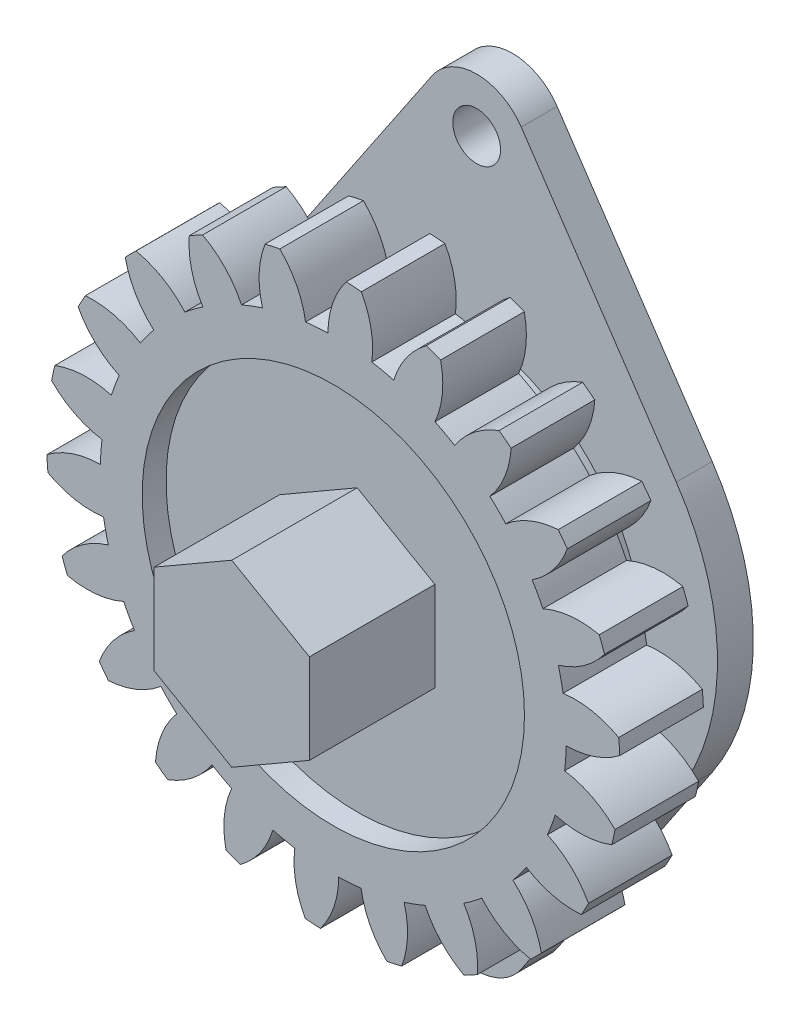
from build123d import *

# Parameters (mm, degrees)
EXTRUDE_1_DEPTH          = 3.5
SKETCH_2_R               = 19.5
EXTRUDE_2_DEPTH          = 7
PATTERN_CIRCULAR_1_COUNT = 22
SKETCH_3_R               = 16
CUT_EXTRUDE_1_DEPTH      = 2
SKETCH_4_R               = 16
EXTRUDE_3_DEPTH          = 3
SKETCH_5_R               = 6
EXTRUDE_4_DEPTH          = 2
SKETCH_6_R               = 2
EXTRUDE_5_DEPTH          = 3
SKETCH_7_R               = 5
EXTRUDE_6_DEPTH          = 2.5
EXTRUDE_7_DEPTH          = 10.5


with BuildPart() as part:
    # 草图1 → 凸台-拉伸1 (new, symmetric)
    with BuildSketch(Plane.XY):
        with BuildLine():
            ThreePointArc((1.077257951, 23.975811046), (-0.049799614, 21.8588225), (-0.453470023, 19.494726593))
            ThreePointArc((-0.453470023, 19.494726593), (1.390805461, 19.450338305), (3.222632926, 19.231865147))
            ThreePointArc((3.222632926, 19.231865147), (3.159441147, 21.629344251), (2.3450627, 23.885156079))
            ThreePointArc((2.3450627, 23.885156079), (1.711760568, 23.938877914), (1.077257951, 23.975811046))
        make_face()
    extrude_1 = extrude(amount=EXTRUDE_1_DEPTH, both=True)

    # 草图2 → 凸台-拉伸2 (add)
    with BuildSketch(Plane.XY.offset(3.5)):
        Circle(SKETCH_2_R)
    extrude(amount=-EXTRUDE_2_DEPTH)

    # 阵列(圆周)1: 凸台-拉伸1 ×22 about axis
    pattern_circular_1_axis = Axis((0, 0, 0), (0, 0, 1))
    for i in range(1, PATTERN_CIRCULAR_1_COUNT):
        add(extrude_1.rotate(pattern_circular_1_axis, i * 360 / PATTERN_CIRCULAR_1_COUNT))

    # 草图3 → 切除-拉伸1 (cut)
    with BuildSketch(Plane.XY.offset(3.5)):
        Circle(SKETCH_3_R)
    extrude(amount=-CUT_EXTRUDE_1_DEPTH, mode=Mode.SUBTRACT)

    # 草图4 → 凸台-拉伸3 (add)
    with BuildSketch(Plane(origin=(0, 0, -3.5), x_dir=(-1, 0, 0), z_dir=(0, 0, -1))):
        with Locations(Location((0, 0, 0), (0, 0, 180))):
            Circle(SKETCH_4_R)
    extrude(amount=EXTRUDE_3_DEPTH)

    # 草图5 → 凸台-拉伸4 (add)
    with BuildSketch(Plane(origin=(0, 0, -6.5), x_dir=(-1, 0, 0), z_dir=(0, 0, -1))):
        Circle(SKETCH_5_R)
    extrude(amount=EXTRUDE_4_DEPTH)

    # 草图6 → 凸台-拉伸5 (add)
    with BuildSketch(Plane(origin=(0, 0, -8.5), x_dir=(-1, 0, 0), z_dir=(0, 0, -1))):
        with BuildLine():
            Line((-3.730929356, 30.515982143), (-16.710418036, 11.268804464))
            ThreePointArc((-16.710418036, 11.268804464), (-20.155, 0), (-16.710418036, -11.268804464))
            Line((-16.710418036, -11.268804464), (-3.730929356, -30.515982143))
            ThreePointArc((-3.730929356, -30.515982143), (0, -32.5), (3.730929356, -30.515982143))
            Line((3.730929356, -30.515982143), (16.710418036, -11.268804464))
            ThreePointArc((16.710418036, -11.268804464), (20.155, 0), (16.710418036, 11.268804464))
            Line((16.710418036, 11.268804464), (3.730929356, 30.515982143))
            ThreePointArc((3.730929356, 30.515982143), (0, 32.5), (-3.730929356, 30.515982143))
        make_face()
        with Locations((0, 28)):
            Circle(SKETCH_6_R, mode=Mode.SUBTRACT)
        with Locations((0, -28)):
            Circle(SKETCH_6_R, mode=Mode.SUBTRACT)
    extrude(amount=EXTRUDE_5_DEPTH)

    # 草图7 → 凸台-拉伸6 (add)
    with BuildSketch(Plane(origin=(0, 0, -11.5), x_dir=(-1, 0, 0), z_dir=(0, 0, -1))):
        Circle(SKETCH_7_R)
    extrude(amount=EXTRUDE_6_DEPTH)

    # 草图8 → 凸台-拉伸7 (add)
    with BuildSketch(Plane.XY.offset(1.5)):
        Polygon((0, 7.505553499), (-6.5, 3.75277675), (-6.5, -3.75277675), (0, -7.505553499), (6.5, -3.75277675), (6.5, 3.75277675), align=None)
    extrude(amount=EXTRUDE_7_DEPTH)


solid = part.part
